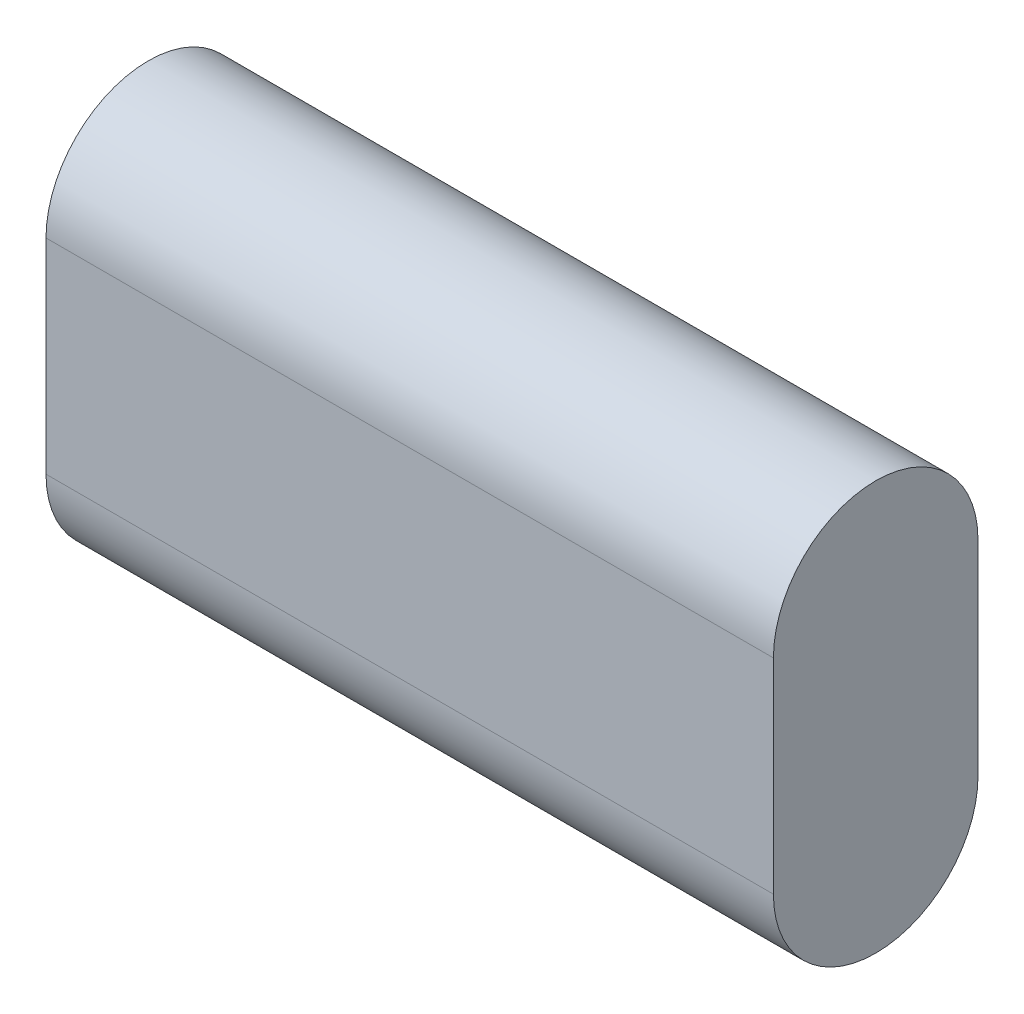
from build123d import *

# Parameters (mm, degrees)
BOSS_EXTRUDE1_DEPTH = 64


with BuildPart() as part:
    # Sketch1 → Boss-Extrude1 (new body)
    with BuildSketch(Plane(origin=(0, 0, 0), x_dir=(0, 0, -1), z_dir=(1, 0, 0))):
        with BuildLine():
            Line((-9, 0), (-9, 18))
            ThreePointArc((-9, 18), (0, 27), (9, 18))
            Line((9, 18), (9, 0))
            ThreePointArc((9, 0), (0, -9), (-9, 0))
        make_face()
    extrude(amount=BOSS_EXTRUDE1_DEPTH)


solid = part.part
